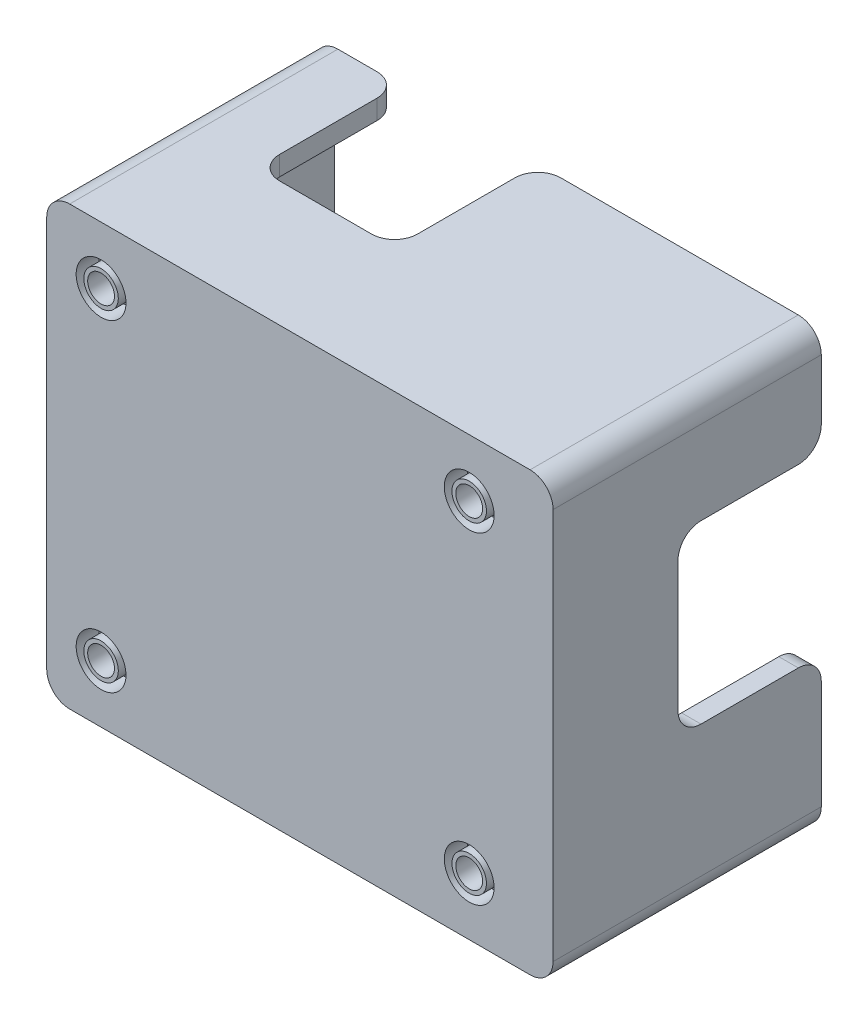
from build123d import *

# Parameters (mm, degrees)
SKETCH1_W             = 61
SKETCH1_H             = 52
BOSS_EXTRUDE1_DEPTH   = 6
SKETCH2_W             = 66.08
SKETCH2_H             = 57.08
SKETCH2_W_2           = 61
SKETCH2_H_2           = 52
BOSS_EXTRUDE2_DEPTH   = 35
SKETCH3_W             = 18
SKETCH3_H             = 2.54
SKETCH3_W_2           = 2.54
SKETCH3_H_2           = 22.981894062
CUT_EXTRUDE1_DEPTH    = 18.7
FILLET1_R             = 3
SKETCH4_R             = 1.75
CUT_EXTRUDE3_DEPTH    = 244.993536095
SKETCH5_R             = 3.25
CUT_EXTRUDE4_DEPTH    = 3
BOSS_EXTRUDE3_START   = -2.75
SKETCH6_R             = 2.25
SKETCH6_R_2           = 1.75
BOSS_EXTRUDE3_DEPTH   = 2.75
BOSS_EXTRUDE3_2_DEPTH = 2.75
BOSS_EXTRUDE3_3_DEPTH = 2.75
BOSS_EXTRUDE3_4_DEPTH = 2.75


with BuildPart() as part:
    # Sketch1 → Boss-Extrude1 (new body)
    with BuildSketch(Plane.XY):
        with Locations((-180.739996617, 85.4335)):
            Rectangle(SKETCH1_W, SKETCH1_H)
    extrude(amount=BOSS_EXTRUDE1_DEPTH)

    # Sketch2 → Boss-Extrude2 (add)
    with BuildSketch(Plane.XY.offset(6)):
        with Locations((-180.739996617, 85.4335)):
            Rectangle(SKETCH2_W, SKETCH2_H)
        with Locations((-180.739996617, 85.4335)):
            Rectangle(SKETCH2_W_2, SKETCH2_H_2, mode=Mode.SUBTRACT)
    extrude(amount=-BOSS_EXTRUDE2_DEPTH)

    # Sketch3 → Cut-Extrude1 (cut)
    with BuildSketch(Plane(origin=(0, 0, -29), x_dir=(-1, 0, 0), z_dir=(0, 0, -1))):
        with Locations((193.68754036, 112.7035)):
            Rectangle(SKETCH3_W, SKETCH3_H)
        with Locations((148.969996617, 88.574898358)):
            Rectangle(SKETCH3_W_2, SKETCH3_H_2)
    extrude(amount=-CUT_EXTRUDE1_DEPTH, mode=Mode.SUBTRACT)

    # Fillet1
    fillet1_edges = [part.edges().sort_by_distance(p)[0] for p in [
        (-150.239996617, 111.4335, -14.5),
        (-150.239996617, 59.4335, -14.5),
        (-211.239996617, 59.4335, -14.5),
        (-211.239996617, 111.4335, -14.5),
        (-213.779996617, 113.9735, -11.5),
        (-147.699996617, 113.9735, -11.5),
        (-147.699996617, 56.8935, -11.5),
        (-213.779996617, 56.8935, -11.5),
        (-202.68754036, 112.7035, -29),
        (-184.68754036, 112.7035, -29),
        (-184.68754036, 112.7035, -10.3),
        (-202.68754036, 112.7035, -10.3),
        (-148.969996617, 100.065845389, -29),
        (-148.969996617, 77.083951327, -29),
        (-148.969996617, 100.065845389, -10.3),
        (-148.969996617, 77.083951327, -10.3),
    ]]
    fillet(fillet1_edges, radius=FILLET1_R)

    # Sketch4 → Cut-Extrude3 (cut, through all)
    with BuildSketch(Plane(origin=(0, 0, 0), x_dir=(-1, 0, 0), z_dir=(0, 0, -1))):
        with Locations((206.685524627, 64.3985)):
            Circle(SKETCH4_R)
        with Locations((158.645524627, 64.3985)):
            Circle(SKETCH4_R)
        with Locations((206.685524627, 106.4685)):
            Circle(SKETCH4_R)
        with Locations((158.645524627, 106.4685)):
            Circle(SKETCH4_R)
    extrude(amount=-CUT_EXTRUDE3_DEPTH, mode=Mode.SUBTRACT)

    # Sketch5 → Cut-Extrude4 (cut)
    with BuildSketch(Plane.XY.offset(6)):
        with Locations((-206.685524627, 64.3985)):
            Circle(SKETCH5_R)
        with Locations((-206.685524627, 106.4685)):
            Circle(SKETCH5_R)
        with Locations((-158.645524627, 64.3985)):
            Circle(SKETCH5_R)
        with Locations((-158.645524627, 106.4685)):
            Circle(SKETCH5_R)
    extrude(amount=-CUT_EXTRUDE4_DEPTH, mode=Mode.SUBTRACT)


with BuildPart() as body_2:
    # Sketch6 → Boss-Extrude3 (new body)
    with BuildSketch(Plane.XY.offset(6).offset(BOSS_EXTRUDE3_START)):
        with Locations((-158.645524627, 64.3985)):
            Circle(SKETCH6_R)
        with Locations((-158.645524627, 64.3985)):
            Circle(SKETCH6_R_2, mode=Mode.SUBTRACT)
    extrude(amount=BOSS_EXTRUDE3_DEPTH)


with BuildPart() as body_3:
    # Sketch6 → Boss-Extrude3 2 (new body)
    with BuildSketch(Plane.XY.offset(6).offset(BOSS_EXTRUDE3_START)):
        with Locations((-206.685524627, 106.4685)):
            Circle(SKETCH6_R)
        with Locations((-206.685524627, 106.4685)):
            Circle(SKETCH6_R_2, mode=Mode.SUBTRACT)
    extrude(amount=BOSS_EXTRUDE3_2_DEPTH)


with BuildPart() as body_4:
    # Sketch6 → Boss-Extrude3 3 (new body)
    with BuildSketch(Plane.XY.offset(6).offset(BOSS_EXTRUDE3_START)):
        with Locations((-158.645524627, 106.4685)):
            Circle(SKETCH6_R)
        with Locations((-158.645524627, 106.4685)):
            Circle(SKETCH6_R_2, mode=Mode.SUBTRACT)
    extrude(amount=BOSS_EXTRUDE3_3_DEPTH)


with BuildPart() as body_5:
    # Sketch6 → Boss-Extrude3 4 (new body)
    with BuildSketch(Plane.XY.offset(6).offset(BOSS_EXTRUDE3_START)):
        with Locations((-206.685524627, 64.3985)):
            Circle(SKETCH6_R)
        with Locations((-206.685524627, 64.3985)):
            Circle(SKETCH6_R_2, mode=Mode.SUBTRACT)
    extrude(amount=BOSS_EXTRUDE3_4_DEPTH)


solid = Compound([part.part, body_2.part, body_3.part, body_4.part, body_5.part])
